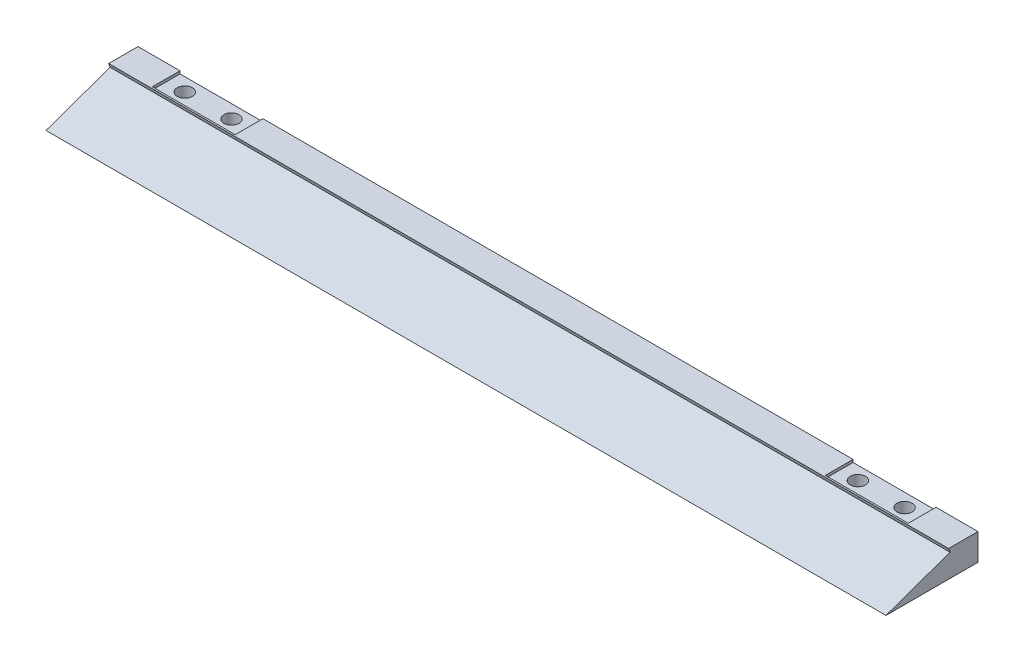
from build123d import *

# Parameters (mm, degrees)
SKETCH1_W            = 200
SKETCH1_H            = 30
BASE_DEPTH           = 6.35
WEDGECUT_REACH       = 202.662
SKETCH3_W            = 19.745999878
SKETCH3_H            = 6.604
HINGE_CUTOUT_DEPTH   = 0.635
HINGE_HOLE_CUT_REACH = 103.28
SKETCH4_R            = 1.8034
SKETCH5_W            = 5.05
SKETCH5_H            = 5.05
HINGE_NUT_CUT_DEPTH  = 2


with BuildPart() as part:
    # Sketch1 → Base (new body)
    with BuildSketch(Plane(origin=(0, 0, 0), x_dir=(1, 0, 0), z_dir=(0, 1, 0))):
        Rectangle(SKETCH1_W, SKETCH1_H)
    extrude(amount=BASE_DEPTH)

    # Sketch2 → WedgeCut (cut, up to next)
    with BuildSketch(Plane(origin=(100, 0, 0), x_dir=(0, 0, -1), z_dir=(1, 0, 0)), mode=Mode.PRIVATE) as wedgecut_sk1:
        Polygon((-15, 0), (-6.907470508, 0), (8.342084542, 5.407501552), (8.007874016, 6.35), (-15, 6.35), align=None)
    wedgecut_tool1 = extrude(wedgecut_sk1.sketch, amount=-WEDGECUT_REACH, mode=Mode.PRIVATE) & part.part
    add(wedgecut_tool1.solids().sort_by_distance((100, 3.70048, 5.888491))[0], mode=Mode.SUBTRACT)

    # Sketch3 → Hinge Cutout (cut)
    with BuildSketch(Plane(origin=(0, 6.35, 0), x_dir=(1, 0, 0), z_dir=(0, 1, 0))):
        with Locations((-80.127000061, 11.698)):
            Rectangle(SKETCH3_W, SKETCH3_H)
        with Locations((80.127000061, 11.698)):
            Rectangle(SKETCH3_W, SKETCH3_H)
    extrude(amount=-HINGE_CUTOUT_DEPTH, mode=Mode.SUBTRACT)

    # Sketch4 → Hinge Hole Cut (cut, up to next)
    with BuildSketch(Plane(origin=(0, 5.715, 0), x_dir=(1, 0, 0), z_dir=(0, 1, 0)), mode=Mode.PRIVATE) as hinge_hole_cut_sk1:
        with Locations(Location((74.564400061, 11.825, 0), (0, 0, 270))):
            Circle(SKETCH4_R)
    hinge_hole_cut_tool1 = extrude(hinge_hole_cut_sk1.sketch, amount=-HINGE_HOLE_CUT_REACH, mode=Mode.PRIVATE) & part.part
    # Sketch4 → Hinge Hole Cut (cut, up to next)
    with BuildSketch(Plane(origin=(0, 5.715, 0), x_dir=(1, 0, 0), z_dir=(0, 1, 0)), mode=Mode.PRIVATE) as hinge_hole_cut_sk2:
        with Locations(Location((85.689600061, 11.825, 0), (0, 0, 270))):
            Circle(SKETCH4_R)
    hinge_hole_cut_tool2 = extrude(hinge_hole_cut_sk2.sketch, amount=-HINGE_HOLE_CUT_REACH, mode=Mode.PRIVATE) & part.part
    hinge_hole_cut_1 = hinge_hole_cut_tool1.solids().sort_by_distance((74.5644, 5.715, -11.825))[0]
    add(hinge_hole_cut_1, mode=Mode.SUBTRACT)
    hinge_hole_cut_2 = hinge_hole_cut_tool2.solids().sort_by_distance((85.6896, 5.715, -11.825))[0]
    add(hinge_hole_cut_2, mode=Mode.SUBTRACT)
    hinge_hole_cut = hinge_hole_cut_1 + hinge_hole_cut_2  # Hinge Hole Cut as one shape, for the pattern or mirror that repeats it

    # Sketch5 → Hinge Nut Cut (cut)
    with BuildSketch(Plane.XZ):
        with Locations((74.564400061, -11.825)):
            Rectangle(SKETCH5_W, SKETCH5_H)
        with Locations((85.689600061, -11.825)):
            Rectangle(SKETCH5_W, SKETCH5_H)
    hinge_nut_cut = extrude(amount=-HINGE_NUT_CUT_DEPTH, mode=Mode.SUBTRACT)

    # Hinge Hole Mirror: Hinge Hole Cut, Hinge Nut Cut across plane
    add(hinge_hole_cut.mirror(Plane(origin=(0, 0, 0), x_dir=(0, 0, 1), z_dir=(1, 0, 0))), mode=Mode.SUBTRACT)
    add(hinge_nut_cut.mirror(Plane(origin=(0, 0, 0), x_dir=(0, 0, 1), z_dir=(1, 0, 0))), mode=Mode.SUBTRACT)


solid = part.part
